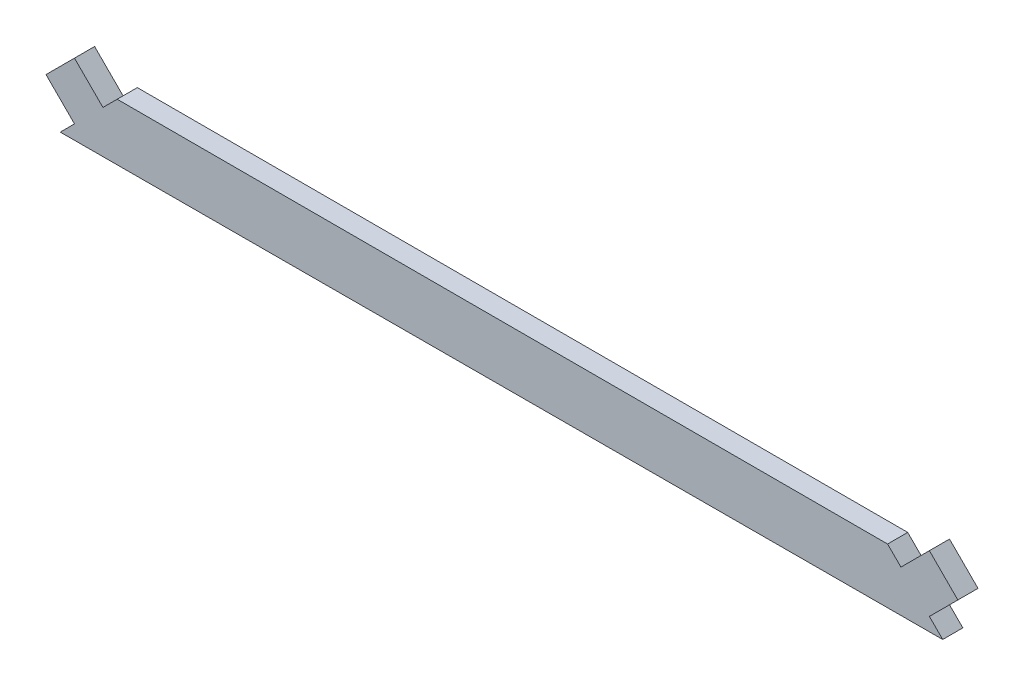
from build123d import *

# Parameters (mm, degrees)
BOSS_EXTRUDE1_DEPTH = 3.175
BOSS_EXTRUDE2_DEPTH = 6.35
BOSS_EXTRUDE4_DEPTH = 6.35


with BuildPart() as part:
    # Sketch1 → Boss-Extrude1 (new, symmetric)
    with BuildSketch(Plane.XY):
        Polygon((-139.443807584, -165.884900532), (138.870288723, -165.311381671), (121.483295342, -147.92438829), (-121.483295342, -147.92438829), align=None)
    extrude(amount=BOSS_EXTRUDE1_DEPTH, both=True)

    # Sketch2 → Boss-Extrude2 (add)
    with BuildSketch(Plane(origin=(0, 0, -3.175), x_dir=(-1, 0, 0), z_dir=(0, 0, -1))):
        Polygon((-125.686663972, -152.12775692), (-134.666920093, -143.147500799), (-143.647176214, -152.12775692), (-134.666920093, -161.108013041), (-138.870288723, -165.311381671), (139.443807584, -165.884900532), (121.483295342, -147.92438829), (-121.483295342, -147.92438829), align=None)
    extrude(amount=-BOSS_EXTRUDE2_DEPTH)

    # Sketch3 → Boss-Extrude4 (add)
    with BuildSketch(Plane(origin=(0, 0, -3.175), x_dir=(-1, 0, 0), z_dir=(0, 0, -1))):
        Polygon((125.973423403, -152.41451635), (134.953679524, -143.434260229), (143.933935645, -152.41451635), (134.953679524, -161.394772471), align=None)
    extrude(amount=-BOSS_EXTRUDE4_DEPTH)


solid = part.part
